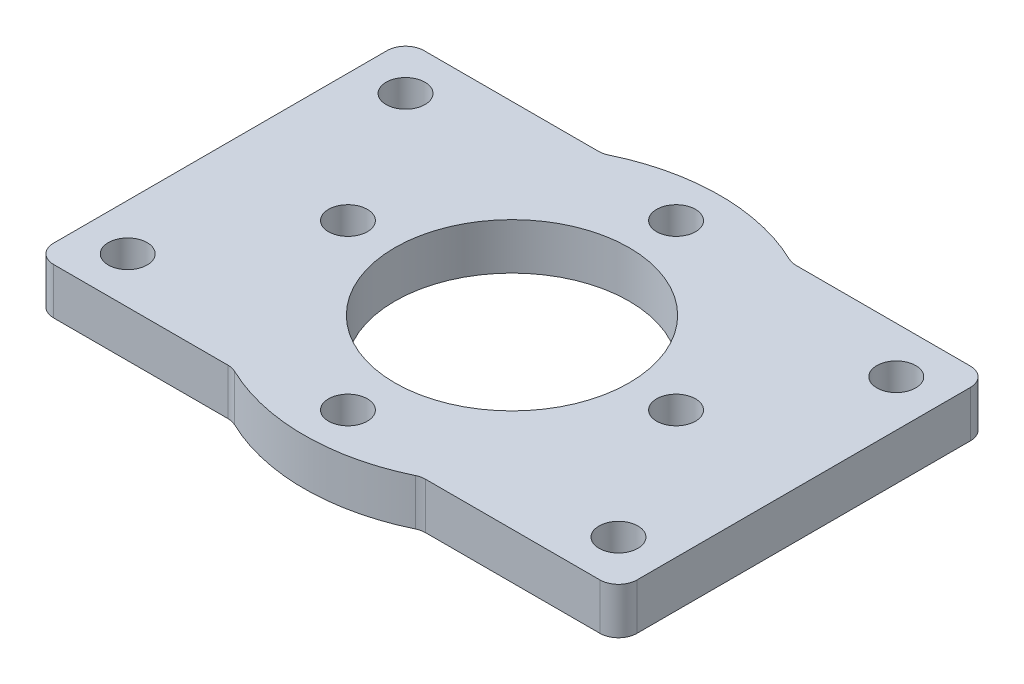
from build123d import *

# Parameters (mm, degrees)
BOSS_EXTRUDE1_DEPTH = 6.35
CUT_EXTRUDE1_REACH  = 51.523
SKETCH2_R           = 16.0655
CUT_EXTRUDE2_REACH  = 51.523
SKETCH3_R           = 2.665
CUT_EXTRUDE3_REACH  = 51.523
SKETCH4_R           = 2.665
FILLET1_R           = 2.54


with BuildPart() as part:
    # Sketch1 → Boss-Extrude1 (new body)
    with BuildSketch(Plane(origin=(0, 0, 0), x_dir=(1, 0, 0), z_dir=(0, 1, 0))):
        with BuildLine():
            Line((-12.926329719, 25.4), (-40, 25.4))
            Line((-40, 25.4), (-40, -25.4))
            Line((-40, -25.4), (-12.926329719, -25.4))
            ThreePointArc((-12.926329719, -25.4), (0, -28.5), (12.926329719, -25.4))
            Line((12.926329719, -25.4), (40, -25.4))
            Line((40, -25.4), (40, 25.4))
            Line((40, 25.4), (12.926329719, 25.4))
            ThreePointArc((12.926329719, 25.4), (0, 28.5), (-12.926329719, 25.4))
        make_face()
    extrude(amount=BOSS_EXTRUDE1_DEPTH)

    # Sketch2 → Cut-Extrude1 (cut, up to next)
    with BuildSketch(Plane(origin=(0, 6.35, 0), x_dir=(1, 0, 0), z_dir=(0, 1, 0)), mode=Mode.PRIVATE) as cut_extrude1_sk1:
        with Locations(Location((0, 0, 0), (0, 0, 270))):
            Circle(SKETCH2_R)
    cut_extrude1_tool1 = extrude(cut_extrude1_sk1.sketch, amount=-CUT_EXTRUDE1_REACH, mode=Mode.PRIVATE) & part.part
    add(cut_extrude1_tool1.solids().sort_by_distance((0, 6.35, 0))[0], mode=Mode.SUBTRACT)

    # Sketch3 → Cut-Extrude2 (cut, up to next)
    with BuildSketch(Plane(origin=(0, 6.35, 0), x_dir=(1, 0, 0), z_dir=(0, 1, 0)), mode=Mode.PRIVATE) as cut_extrude2_sk1:
        with Locations(Location((0, 22.5, 0), (0, 0, 270))):
            Circle(SKETCH3_R)
    cut_extrude2_tool1 = extrude(cut_extrude2_sk1.sketch, amount=-CUT_EXTRUDE2_REACH, mode=Mode.PRIVATE) & part.part
    # Sketch3 → Cut-Extrude2 (cut, up to next)
    with BuildSketch(Plane(origin=(0, 6.35, 0), x_dir=(1, 0, 0), z_dir=(0, 1, 0)), mode=Mode.PRIVATE) as cut_extrude2_sk2:
        with Locations(Location((22.5, 0, 0), (0, 0, 270))):
            Circle(SKETCH3_R)
    cut_extrude2_tool2 = extrude(cut_extrude2_sk2.sketch, amount=-CUT_EXTRUDE2_REACH, mode=Mode.PRIVATE) & part.part
    # Sketch3 → Cut-Extrude2 (cut, up to next)
    with BuildSketch(Plane(origin=(0, 6.35, 0), x_dir=(1, 0, 0), z_dir=(0, 1, 0)), mode=Mode.PRIVATE) as cut_extrude2_sk3:
        with Locations(Location((0, -22.5, 0), (0, 0, 270))):
            Circle(SKETCH3_R)
    cut_extrude2_tool3 = extrude(cut_extrude2_sk3.sketch, amount=-CUT_EXTRUDE2_REACH, mode=Mode.PRIVATE) & part.part
    # Sketch3 → Cut-Extrude2 (cut, up to next)
    with BuildSketch(Plane(origin=(0, 6.35, 0), x_dir=(1, 0, 0), z_dir=(0, 1, 0)), mode=Mode.PRIVATE) as cut_extrude2_sk4:
        with Locations(Location((-22.5, 0, 0), (0, 0, 270))):
            Circle(SKETCH3_R)
    cut_extrude2_tool4 = extrude(cut_extrude2_sk4.sketch, amount=-CUT_EXTRUDE2_REACH, mode=Mode.PRIVATE) & part.part
    add(cut_extrude2_tool1.solids().sort_by_distance((0, 6.35, -22.5))[0], mode=Mode.SUBTRACT)
    add(cut_extrude2_tool2.solids().sort_by_distance((22.5, 6.35, 0))[0], mode=Mode.SUBTRACT)
    add(cut_extrude2_tool3.solids().sort_by_distance((0, 6.35, 22.5))[0], mode=Mode.SUBTRACT)
    add(cut_extrude2_tool4.solids().sort_by_distance((-22.5, 6.35, 0))[0], mode=Mode.SUBTRACT)

    # Sketch4 → Cut-Extrude3 (cut, up to next)
    with BuildSketch(Plane(origin=(0, 6.35, 0), x_dir=(1, 0, 0), z_dir=(0, 1, 0)), mode=Mode.PRIVATE) as cut_extrude3_sk1:
        with Locations(Location((-33.65, 19.05, 0), (0, 0, 270))):
            Circle(SKETCH4_R)
    cut_extrude3_tool1 = extrude(cut_extrude3_sk1.sketch, amount=-CUT_EXTRUDE3_REACH, mode=Mode.PRIVATE) & part.part
    # Sketch4 → Cut-Extrude3 (cut, up to next)
    with BuildSketch(Plane(origin=(0, 6.35, 0), x_dir=(1, 0, 0), z_dir=(0, 1, 0)), mode=Mode.PRIVATE) as cut_extrude3_sk2:
        with Locations(Location((-33.65, -19.05, 0), (0, 0, 270))):
            Circle(SKETCH4_R)
    cut_extrude3_tool2 = extrude(cut_extrude3_sk2.sketch, amount=-CUT_EXTRUDE3_REACH, mode=Mode.PRIVATE) & part.part
    # Sketch4 → Cut-Extrude3 (cut, up to next)
    with BuildSketch(Plane(origin=(0, 6.35, 0), x_dir=(1, 0, 0), z_dir=(0, 1, 0)), mode=Mode.PRIVATE) as cut_extrude3_sk3:
        with Locations(Location((33.65, 19.05, 0), (0, 0, 270))):
            Circle(SKETCH4_R)
    cut_extrude3_tool3 = extrude(cut_extrude3_sk3.sketch, amount=-CUT_EXTRUDE3_REACH, mode=Mode.PRIVATE) & part.part
    # Sketch4 → Cut-Extrude3 (cut, up to next)
    with BuildSketch(Plane(origin=(0, 6.35, 0), x_dir=(1, 0, 0), z_dir=(0, 1, 0)), mode=Mode.PRIVATE) as cut_extrude3_sk4:
        with Locations(Location((33.65, -19.05, 0), (0, 0, 270))):
            Circle(SKETCH4_R)
    cut_extrude3_tool4 = extrude(cut_extrude3_sk4.sketch, amount=-CUT_EXTRUDE3_REACH, mode=Mode.PRIVATE) & part.part
    add(cut_extrude3_tool1.solids().sort_by_distance((-33.65, 6.35, -19.05))[0], mode=Mode.SUBTRACT)
    add(cut_extrude3_tool2.solids().sort_by_distance((-33.65, 6.35, 19.05))[0], mode=Mode.SUBTRACT)
    add(cut_extrude3_tool3.solids().sort_by_distance((33.65, 6.35, -19.05))[0], mode=Mode.SUBTRACT)
    add(cut_extrude3_tool4.solids().sort_by_distance((33.65, 6.35, 19.05))[0], mode=Mode.SUBTRACT)

    # Fillet1
    fillet1_edges = [part.edges().sort_by_distance(p)[0] for p in [
        (12.926329719, 3.175, -25.4),
        (40, 3.175, -25.4),
        (40, 3.175, 25.4),
        (12.926329719, 3.175, 25.4),
        (-12.926329719, 3.175, 25.4),
        (-40, 3.175, 25.4),
        (-40, 3.175, -25.4),
        (-12.926329719, 3.175, -25.4),
    ]]
    fillet(fillet1_edges, radius=FILLET1_R)


solid = part.part
